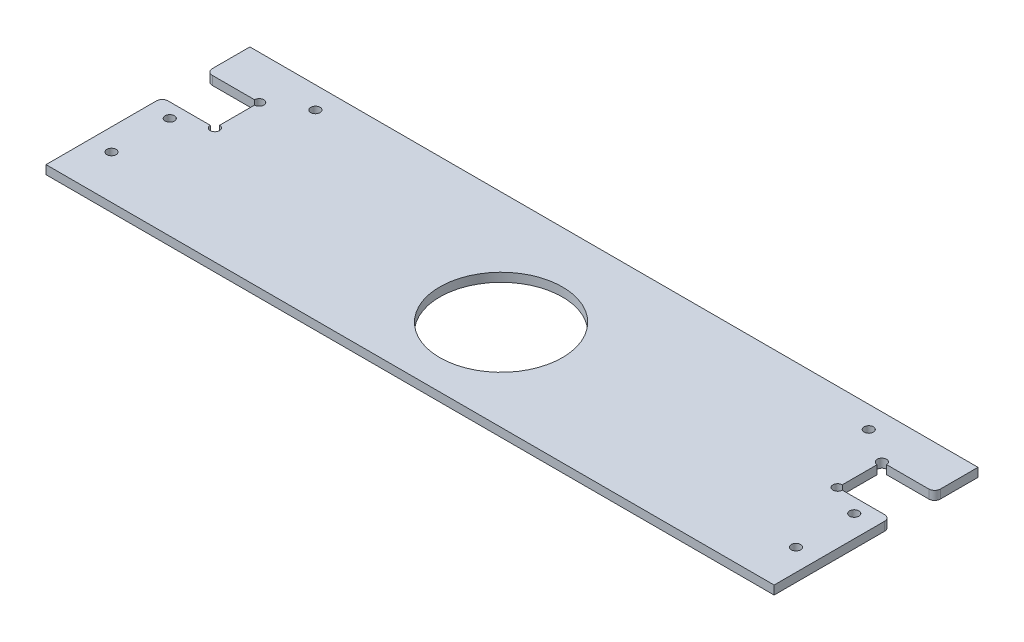
from build123d import *

# Parameters (mm, degrees)
SKETCH_1_W          = 250
SKETCH_1_H          = 70
EXTRUDE_1_DEPTH     = 3
SKETCH_2_R          = 1.6
CUT_EXTRUDE_1_DEPTH = 130.842211934
SKETCH_4_W          = 18.1
SKETCH_4_H          = 15.2
CUT_EXTRUDE_3_DEPTH = 130.842211934
FILLET_2_R          = 2
SKETCH_5_R          = 1.6
CUT_EXTRUDE_4_DEPTH = 130.842211934
SKETCH_6_R          = 21.05
CUT_EXTRUDE_5_DEPTH = 130.842211934


with BuildPart() as part:
    # 草图1 → 凸台-拉伸1 (new body)
    with BuildSketch(Plane(origin=(0, 0, 0), x_dir=(1, 0, 0), z_dir=(0, 1, 0))):
        Rectangle(SKETCH_1_W, SKETCH_1_H)
    extrude(amount=EXTRUDE_1_DEPTH)

    # 草图2 → 切除-拉伸1 (cut, through all)
    with BuildSketch(Plane(origin=(0, 3, 0), x_dir=(1, 0, 0), z_dir=(0, 1, 0))):
        with Locations(Location((-95, 27.5, 0), (0, 0, 270))):
            Circle(SKETCH_2_R)
        with Locations(Location((95, 27.5, 0), (0, 0, 270))):
            Circle(SKETCH_2_R)
        with Locations(Location((-117.5, 0, 0), (0, 0, 270))):
            Circle(SKETCH_2_R)
        with Locations(Location((-117.5, -20, 0), (0, 0, 270))):
            Circle(SKETCH_2_R)
        with Locations(Location((117.5, -20, 0), (0, 0, 90))):
            Circle(SKETCH_2_R)
        with Locations(Location((117.5, 0, 0), (0, 0, 90))):
            Circle(SKETCH_2_R)
    extrude(amount=-CUT_EXTRUDE_1_DEPTH, mode=Mode.SUBTRACT)

    # 草图4 → 切除-拉伸3 (cut, through all)
    with BuildSketch(Plane(origin=(0, 3, 0), x_dir=(1, 0, 0), z_dir=(0, 1, 0))):
        with Locations((-115.95, 12.5)):
            Rectangle(SKETCH_4_W, SKETCH_4_H)
        with Locations((115.95, 12.5)):
            Rectangle(SKETCH_4_W, SKETCH_4_H)
    extrude(amount=-CUT_EXTRUDE_3_DEPTH, mode=Mode.SUBTRACT)

    # 圆角2
    fillet_2_edges = [part.edges().sort_by_distance(p)[0] for p in [
        (-125, 1.5, -4.9),
        (-125, 1.5, -20.1),
        (125, 1.5, -20.1),
        (125, 1.5, -4.9),
    ]]
    fillet(fillet_2_edges, radius=FILLET_2_R)

    # 草图5 → 切除-拉伸4 (cut, through all)
    with BuildSketch(Plane(origin=(0, 3, 0), x_dir=(1, 0, 0), z_dir=(0, 1, 0))):
        with Locations((-106.9, 20.1)):
            Circle(SKETCH_5_R)
        with Locations((-106.9, 4.9)):
            Circle(SKETCH_5_R)
        with Locations((106.9, 4.9)):
            Circle(SKETCH_5_R)
        with Locations((106.9, 20.1)):
            Circle(SKETCH_5_R)
    extrude(amount=-CUT_EXTRUDE_4_DEPTH, mode=Mode.SUBTRACT)

    # 草图6 → 切除-拉伸5 (cut, through all)
    with BuildSketch(Plane(origin=(0, 3, 0), x_dir=(1, 0, 0), z_dir=(0, 1, 0))):
        with Locations(Location((0, -3.75, 0), (0, 0, 270))):
            Circle(SKETCH_6_R)
    extrude(amount=-CUT_EXTRUDE_5_DEPTH, mode=Mode.SUBTRACT)


solid = part.part
